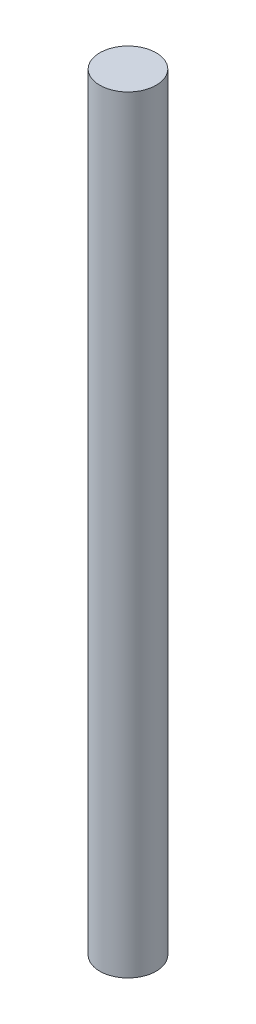
from build123d import *

# Parameters (mm, degrees)
SKETCH1_R           = 80.75
BOSS_EXTRUDE1_DEPTH = 2200


with BuildPart() as part:
    # Sketch1 → Boss-Extrude1 (new body)
    with BuildSketch(Plane(origin=(0, 0, 0), x_dir=(1, 0, 0), z_dir=(0, 1, 0))):
        with Locations(Location((0, 0, 0), (0, 0, 270))):
            Circle(SKETCH1_R)
    extrude(amount=BOSS_EXTRUDE1_DEPTH)


solid = part.part
